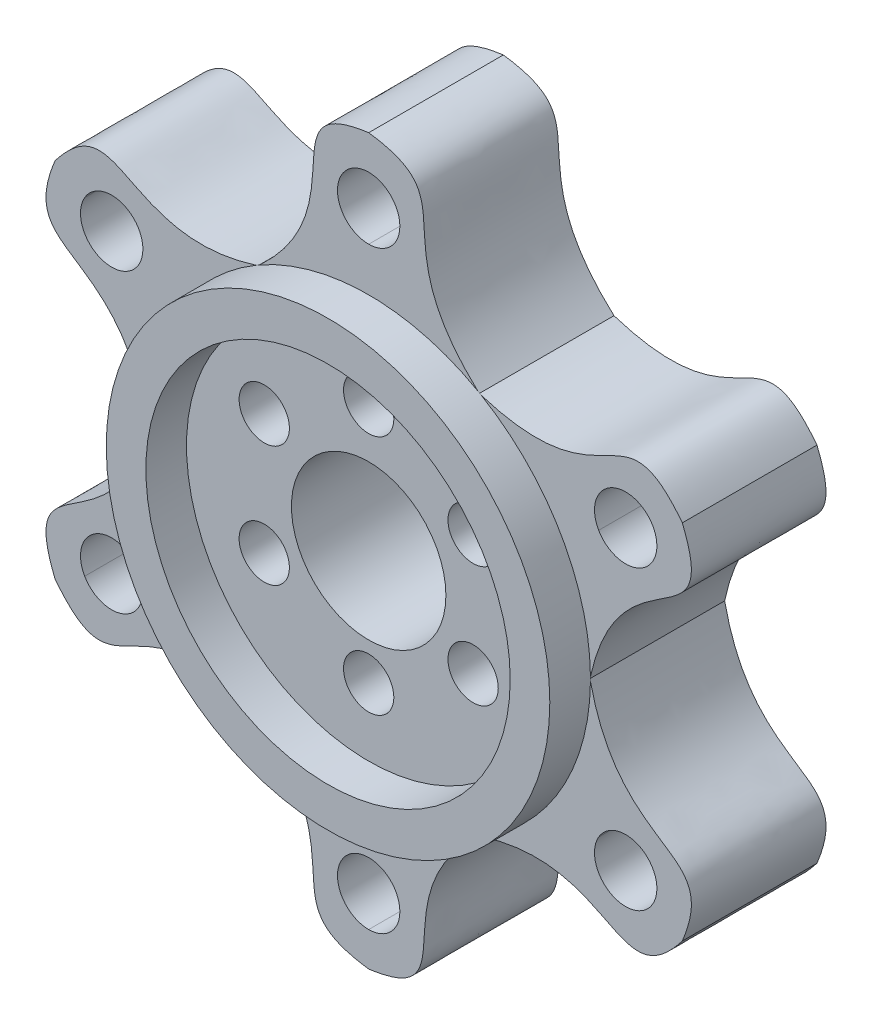
from build123d import *

# Parameters (mm, degrees)
SKETCH1_R           = 45.72
SKETCH1_R_2         = 9.75
SKETCH1_R_3         = 3.175
SKETCH1_R_4         = 3.937
BOSS_EXTRUDE3_DEPTH = 17.000000036
CUT_EXTRUDE1_START  = -22.86
CUT_EXTRUDE1_DEPTH  = 22.86
SKETCH4_R           = 28
SKETCH4_R_2         = 23
BOSS_EXTRUDE4_DEPTH = 5.1308


with BuildPart() as part:
    # Sketch1 → Boss-Extrude3 (new body)
    with BuildSketch(Plane.XY):
        Circle(SKETCH1_R)
        Circle(SKETCH1_R_2, mode=Mode.SUBTRACT)
        with Locations((0, 16.002)):
            Circle(SKETCH1_R_3, mode=Mode.SUBTRACT)
        with Locations((13.184862266, 8.389716222)):
            Circle(SKETCH1_R_3, mode=Mode.SUBTRACT)
        with Locations((13.184862266, -6.834851335)):
            Circle(SKETCH1_R_3, mode=Mode.SUBTRACT)
        with Locations((0, -14.447135113)):
            Circle(SKETCH1_R_3, mode=Mode.SUBTRACT)
        with Locations((-13.184862266, -6.834851335)):
            Circle(SKETCH1_R_3, mode=Mode.SUBTRACT)
        with Locations((-13.184862266, 8.389716222)):
            Circle(SKETCH1_R_3, mode=Mode.SUBTRACT)
        with Locations((0, 37.465)):
            Circle(SKETCH1_R_4, mode=Mode.SUBTRACT)
        with Locations((32.445641753, 18.7325)):
            Circle(SKETCH1_R_4, mode=Mode.SUBTRACT)
        with Locations((32.445641753, -18.7325)):
            Circle(SKETCH1_R_4, mode=Mode.SUBTRACT)
        with Locations((0, -37.465)):
            Circle(SKETCH1_R_4, mode=Mode.SUBTRACT)
        with Locations((-32.445641753, -18.7325)):
            Circle(SKETCH1_R_4, mode=Mode.SUBTRACT)
        with Locations((-32.445641753, 18.7325)):
            Circle(SKETCH1_R_4, mode=Mode.SUBTRACT)
    extrude(amount=BOSS_EXTRUDE3_DEPTH)

    # Sketch2 → Cut-Extrude1 (cut)
    with BuildSketch(Plane.XY.offset(17.000000036).offset(CUT_EXTRUDE1_START)):
        with BuildLine():
            ThreePointArc((39.594681461, -22.86), (45.72, 0), (39.594681461, 22.86))
            add(Edge.make_bspline(
                [(27.94, 0), (31.622092251, 17.195322725), (44.628878831, 10.61767176), (39.594681461, 22.86)],
                knots=[0, 0, 0, 0, 1, 1, 1, 1], degree=3))
            add(Edge.make_bspline(
                [(27.94, 0), (31.622092251, -17.195322725), (44.628878831, -10.61767176), (39.594681461, -22.86)],
                knots=[0, 0, 0, 0, 1, 1, 1, 1], degree=3))
        make_face()
        with BuildLine():
            add(Edge.make_bspline(
                [(13.97, 24.196749782), (30.702632431, 18.787873847), (31.509612889, 33.34090693), (39.594681461, 22.86)],
                knots=[0, 0, 0, 0, 1, 1, 1, 1], degree=3))
            ThreePointArc((39.594681461, 22.86), (22.86, 39.594681461), (0, 45.72))
            add(Edge.make_bspline(
                [(13.97, 24.196749782), (0.919459819, 35.983196572), (13.119265943, 43.95857869), (0, 45.72)],
                knots=[0, 0, 0, 0, 1, 1, 1, 1], degree=3))
        make_face()
        with BuildLine():
            ThreePointArc((0, -45.72), (22.86, -39.594681461), (39.594681461, -22.86))
            add(Edge.make_bspline(
                [(13.97, -24.196749782), (30.702632431, -18.787873847), (31.509612889, -33.34090693), (39.594681461, -22.86)],
                knots=[0, 0, 0, 0, 1, 1, 1, 1], degree=3))
            add(Edge.make_bspline(
                [(13.97, -24.196749782), (0.919459819, -35.983196572), (13.119265943, -43.95857869), (0, -45.72)],
                knots=[0, 0, 0, 0, 1, 1, 1, 1], degree=3))
        make_face()
        with BuildLine():
            add(Edge.make_bspline(
                [(-13.97, 24.196749782), (-0.919459819, 35.983196572), (-13.119265943, 43.95857869), (0, 45.72)],
                knots=[0, 0, 0, 0, 1, 1, 1, 1], degree=3))
            ThreePointArc((0, 45.72), (-22.86, 39.594681461), (-39.594681461, 22.86))
            add(Edge.make_bspline(
                [(-13.97, 24.196749782), (-30.702632431, 18.787873847), (-31.509612889, 33.34090693), (-39.594681461, 22.86)],
                knots=[0, 0, 0, 0, 1, 1, 1, 1], degree=3))
        make_face()
        with BuildLine():
            ThreePointArc((-39.594681461, -22.86), (-22.86, -39.594681461), (0, -45.72))
            add(Edge.make_bspline(
                [(-13.97, -24.196749782), (-0.919459819, -35.983196572), (-13.119265943, -43.95857869), (0, -45.72)],
                knots=[0, 0, 0, 0, 1, 1, 1, 1], degree=3))
            add(Edge.make_bspline(
                [(-13.97, -24.196749782), (-30.702632431, -18.787873847), (-31.509612889, -33.34090693), (-39.594681461, -22.86)],
                knots=[0, 0, 0, 0, 1, 1, 1, 1], degree=3))
        make_face()
        with BuildLine():
            add(Edge.make_bspline(
                [(-27.94, 0), (-31.622092251, 17.195322725), (-44.628878831, 10.61767176), (-39.594681461, 22.86)],
                knots=[0, 0, 0, 0, 1, 1, 1, 1], degree=3))
            ThreePointArc((-39.594681461, 22.86), (-45.72, 0), (-39.594681461, -22.86))
            add(Edge.make_bspline(
                [(-27.94, 0), (-31.622092251, -17.195322725), (-44.628878831, -10.61767176), (-39.594681461, -22.86)],
                knots=[0, 0, 0, 0, 1, 1, 1, 1], degree=3))
        make_face()
    extrude(amount=CUT_EXTRUDE1_DEPTH, mode=Mode.SUBTRACT)

    # Sketch4 → Boss-Extrude4 (add)
    with BuildSketch(Plane.XY.offset(17.000000036)):
        Circle(SKETCH4_R)
        Circle(SKETCH4_R_2, mode=Mode.SUBTRACT)
    extrude(amount=BOSS_EXTRUDE4_DEPTH)


solid = part.part
